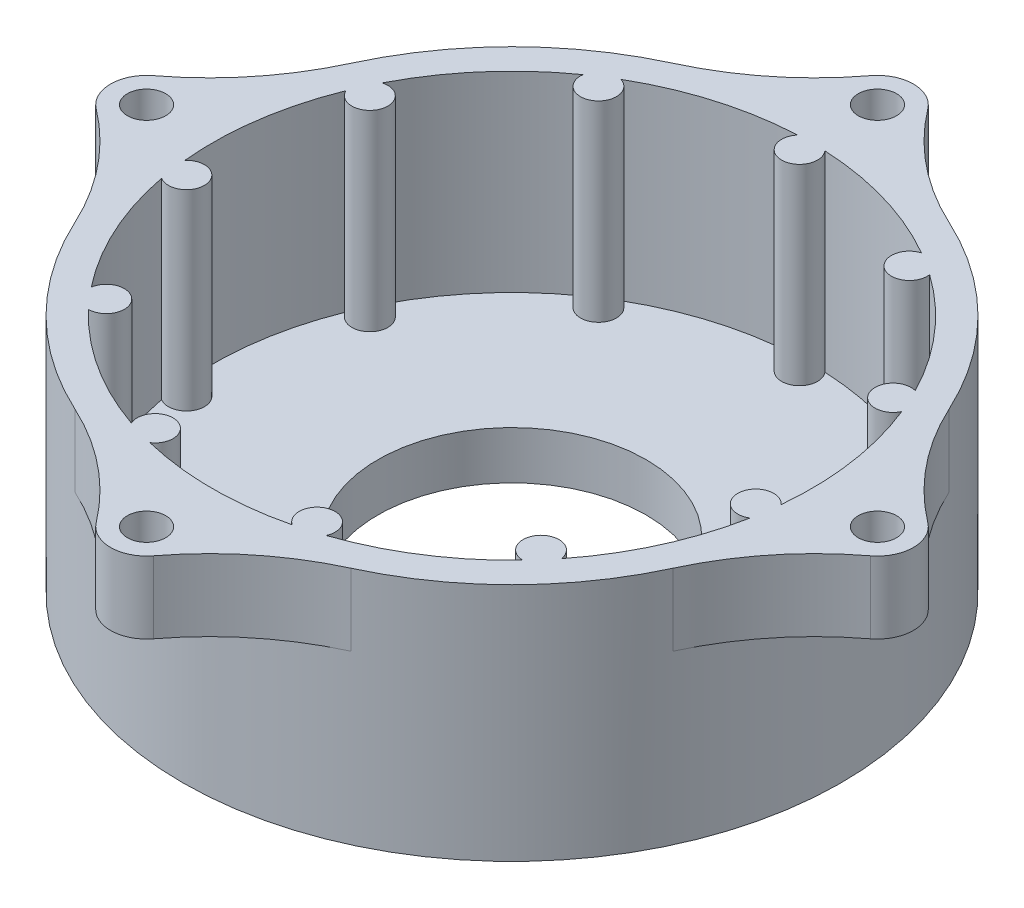
from build123d import *

# Parameters (mm, degrees)
SKETCH1_R               = 27.5
BOSS_EXTRUDE1_DEPTH     = 16
BOSS_EXTRUDE2_START     = -4
SKETCH1_3_R             = 27.5
BOSS_EXTRUDE2_DEPTH     = 4
CUT_EXTRUDE1_DEPTH      = 43.053537307
CUT_EXTRUDE1_DEPTH_BACK = 43.053537307
SKETCH1_5_R             = 11.2
SKETCH6_R               = 3
SKETCH6_R_2             = 1.6
BOSS_EXTRUDE6_DEPTH     = 6
BOSS_EXTRUDE6_2_DEPTH   = 6
BOSS_EXTRUDE6_3_DEPTH   = 6
BOSS_EXTRUDE6_4_DEPTH   = 6
BOSS_EXTRUDE8_START     = -6
SKETCH8_R               = 1.6
BOSS_EXTRUDE8_DEPTH     = 6


with BuildPart() as part:
    # Sketch1 → Boss-Extrude1 (new body)
    with BuildSketch(Plane(origin=(0, 0, 0), x_dir=(1, 0, 0), z_dir=(0, 1, 0))):
        with Locations(Location((0, 0, 0), (0, 0, 270))):
            Circle(SKETCH1_R)
        with BuildLine():
            ThreePointArc((1.140791464, 24.973958333), (7.043313921, 23.98732434), (12.542246399, 21.626189106))
            ThreePointArc((12.542246399, 21.626189106), (12.164418393, 18.928204489), (14.461636098, 20.392672247))
            ThreePointArc((14.461636098, 20.392672247), (18.893739359, 16.371518349), (22.24320965, 11.412257642))
            ThreePointArc((22.24320965, 11.412257642), (20.466719895, 9.346837793), (23.191013452, 9.33685681))
            ThreePointArc((23.191013452, 9.33685681), (24.745536047, 3.557870957), (24.882111, -2.424984989))
            ThreePointArc((24.882111, -2.424984989), (22.270982442, -3.202083861), (24.557407894, -4.683344693))
            ThreePointArc((24.557407894, -4.683344693), (22.740799884, -10.385375325), (19.621117916, -15.49231202))
            ThreePointArc((19.621117916, -15.49231202), (17.004365423, -14.734366514), (18.126998845, -17.216617347))
            ThreePointArc((18.126998845, -17.216617347), (13.516020436, -21.031338321), (8.13055853, -23.640939448))
            ThreePointArc((8.13055853, -23.640939448), (6.338982529, -21.588591906), (5.941395741, -24.28373564))
            ThreePointArc((5.941395741, -24.28373564), (0, -25), (-5.941395741, -24.28373564))
            ThreePointArc((-5.941395741, -24.28373564), (-6.338982529, -21.588591906), (-8.13055853, -23.640939448))
            ThreePointArc((-8.13055853, -23.640939448), (-13.516020436, -21.031338321), (-18.126998845, -17.216617347))
            ThreePointArc((-18.126998845, -17.216617347), (-17.004365423, -14.734366514), (-19.621117916, -15.49231202))
            ThreePointArc((-19.621117916, -15.49231202), (-22.740799884, -10.385375325), (-24.557407894, -4.683344693))
            ThreePointArc((-24.557407894, -4.683344693), (-22.270982442, -3.202083861), (-24.882111, -2.424984989))
            ThreePointArc((-24.882111, -2.424984989), (-24.745536047, 3.557870957), (-23.191013452, 9.33685681))
            ThreePointArc((-23.191013452, 9.33685681), (-20.466719895, 9.346837793), (-22.24320965, 11.412257642))
            ThreePointArc((-22.24320965, 11.412257642), (-18.893739359, 16.371518349), (-14.461636098, 20.392672247))
            ThreePointArc((-14.461636098, 20.392672247), (-12.164418393, 18.928204489), (-12.542246399, 21.626189106))
            ThreePointArc((-12.542246399, 21.626189106), (-7.043313921, 23.98732434), (-1.140791464, 24.973958333))
            ThreePointArc((-1.140791464, 24.973958333), (0, 22.5), (1.140791464, 24.973958333))
        make_face(mode=Mode.SUBTRACT)
    extrude(amount=BOSS_EXTRUDE1_DEPTH)

    # Sketch1<3> → Boss-Extrude2 (add)
    with BuildSketch(Plane(origin=(0, 0, 0), x_dir=(1, 0, 0), z_dir=(0, 1, 0)).offset(BOSS_EXTRUDE2_START)):
        with Locations(Location((0, 0, 0), (0, 0, 270))):
            Circle(SKETCH1_3_R)
    extrude(amount=BOSS_EXTRUDE2_DEPTH)

    # Sketch1<5> → Cut-Extrude1 (cut, two sides: drawn at the far end of the back side and taken through both)
    with BuildSketch(Plane(origin=(0, 0, 0), x_dir=(1, 0, 0), z_dir=(0, 1, 0)).offset(-CUT_EXTRUDE1_DEPTH_BACK)):
        with Locations(Location((0, 0, 0), (0, 0, 270))):
            Circle(SKETCH1_5_R)
    extrude(amount=CUT_EXTRUDE1_DEPTH + CUT_EXTRUDE1_DEPTH_BACK, mode=Mode.SUBTRACT)



with BuildPart() as body_2:
    # Sketch6 → Boss-Extrude6 (new body)
    with BuildSketch(Plane(origin=(0, 10, 0), x_dir=(1, 0, 0), z_dir=(0, 1, 0))):
        with Locations(Location((-30.5, 0, 0), (0, 0, 270))):
            Circle(SKETCH6_R)
        with Locations(Location((-30.5, 0, 0), (0, 0, 270))):
            Circle(SKETCH6_R_2, mode=Mode.SUBTRACT)
    extrude(amount=BOSS_EXTRUDE6_DEPTH)


with BuildPart() as body_3:
    # Sketch6 → Boss-Extrude6 2 (new body)
    with BuildSketch(Plane(origin=(0, 10, 0), x_dir=(1, 0, 0), z_dir=(0, 1, 0))):
        with Locations(Location((0, 30.5, 0), (0, 0, 270))):
            Circle(SKETCH6_R)
        with Locations(Location((0, 30.5, 0), (0, 0, 270))):
            Circle(SKETCH6_R_2, mode=Mode.SUBTRACT)
    extrude(amount=BOSS_EXTRUDE6_2_DEPTH)


with BuildPart() as body_4:
    # Sketch6 → Boss-Extrude6 3 (new body)
    with BuildSketch(Plane(origin=(0, 10, 0), x_dir=(1, 0, 0), z_dir=(0, 1, 0))):
        with Locations(Location((30.5, 0, 0), (0, 0, 270))):
            Circle(SKETCH6_R)
        with Locations(Location((30.5, 0, 0), (0, 0, 270))):
            Circle(SKETCH6_R_2, mode=Mode.SUBTRACT)
    extrude(amount=BOSS_EXTRUDE6_3_DEPTH)


with BuildPart() as body_5:
    # Sketch6 → Boss-Extrude6 4 (new body)
    with BuildSketch(Plane(origin=(0, 10, 0), x_dir=(1, 0, 0), z_dir=(0, 1, 0))):
        with Locations(Location((0, -30.5, 0), (0, 0, 270))):
            Circle(SKETCH6_R)
        with Locations(Location((0, -30.5, 0), (0, 0, 270))):
            Circle(SKETCH6_R_2, mode=Mode.SUBTRACT)
    extrude(amount=BOSS_EXTRUDE6_4_DEPTH)


with BuildPart() as part_1:
    add(part.part)

    add(body_2.part)  # Boss-Extrude8 merges body 2

    add(body_3.part)  # Boss-Extrude8 merges body 3

    add(body_4.part)  # Boss-Extrude8 merges body 4

    add(body_5.part)  # Boss-Extrude8 merges body 5
    # Sketch8 → Boss-Extrude8 (add)
    # profile 1 of 4: a face of its own
    with BuildSketch(Plane(origin=(0, 16, 0), x_dir=(1, 0, 0), z_dir=(0, 1, 0)).offset(BOSS_EXTRUDE8_START)):
        with BuildLine():
            ThreePointArc((-32.31166617, -2.391205906), (-28.079459744, -6.502708785), (-24.971529598, -11.518364013))
            ThreePointArc((-24.971529598, -11.518364013), (-27.5, 0), (-24.971529598, 11.518364013))
            ThreePointArc((-24.971529598, 11.518364013), (-28.079459744, 6.502708785), (-32.31166617, 2.391205906))
            ThreePointArc((-32.31166617, 2.391205906), (-33.5, 0), (-32.31166617, -2.391205906))
        make_face()
        with Locations(Location((-30.5, 0, 0), (0, 0, 270))):
            Circle(SKETCH8_R, mode=Mode.SUBTRACT)
    # profile 2 of 4: a face of its own
    with BuildSketch(Plane(origin=(0, 16, 0), x_dir=(1, 0, 0), z_dir=(0, 1, 0)).offset(BOSS_EXTRUDE8_START)):
        with BuildLine():
            ThreePointArc((-2.391205906, 32.31166617), (-6.502708785, 28.079459744), (-11.518364013, 24.971529598))
            ThreePointArc((-11.518364013, 24.971529598), (0, 27.5), (11.518364013, 24.971529598))
            ThreePointArc((11.518364013, 24.971529598), (6.502708785, 28.079459744), (2.391205906, 32.31166617))
            ThreePointArc((2.391205906, 32.31166617), (0, 33.5), (-2.391205906, 32.31166617))
        make_face()
        with Locations(Location((0, 30.5, 0), (0, 0, 270))):
            Circle(SKETCH8_R, mode=Mode.SUBTRACT)
    # profile 3 of 4: a face of its own
    with BuildSketch(Plane(origin=(0, 16, 0), x_dir=(1, 0, 0), z_dir=(0, 1, 0)).offset(BOSS_EXTRUDE8_START)):
        with BuildLine():
            ThreePointArc((32.31166617, 2.391205906), (28.079459744, 6.502708785), (24.971529598, 11.518364013))
            ThreePointArc((24.971529598, 11.518364013), (27.5, 0), (24.971529598, -11.518364013))
            ThreePointArc((24.971529598, -11.518364013), (28.079459744, -6.502708785), (32.31166617, -2.391205906))
            ThreePointArc((32.31166617, -2.391205906), (33.5, 0), (32.31166617, 2.391205906))
        make_face()
        with Locations(Location((30.5, 0, 0), (0, 0, 270))):
            Circle(SKETCH8_R, mode=Mode.SUBTRACT)
    # profile 4 of 4: a face of its own
    with BuildSketch(Plane(origin=(0, 16, 0), x_dir=(1, 0, 0), z_dir=(0, 1, 0)).offset(BOSS_EXTRUDE8_START)):
        with BuildLine():
            ThreePointArc((2.391205906, -32.31166617), (6.502708785, -28.079459744), (11.518364013, -24.971529598))
            ThreePointArc((11.518364013, -24.971529598), (0, -27.5), (-11.518364013, -24.971529598))
            ThreePointArc((-11.518364013, -24.971529598), (-6.502708785, -28.079459744), (-2.391205906, -32.31166617))
            ThreePointArc((-2.391205906, -32.31166617), (0, -33.5), (2.391205906, -32.31166617))
        make_face()
        with Locations(Location((0, -30.5, 0), (0, 0, 270))):
            Circle(SKETCH8_R, mode=Mode.SUBTRACT)
    extrude(amount=BOSS_EXTRUDE8_DEPTH)


solid = part_1.part
